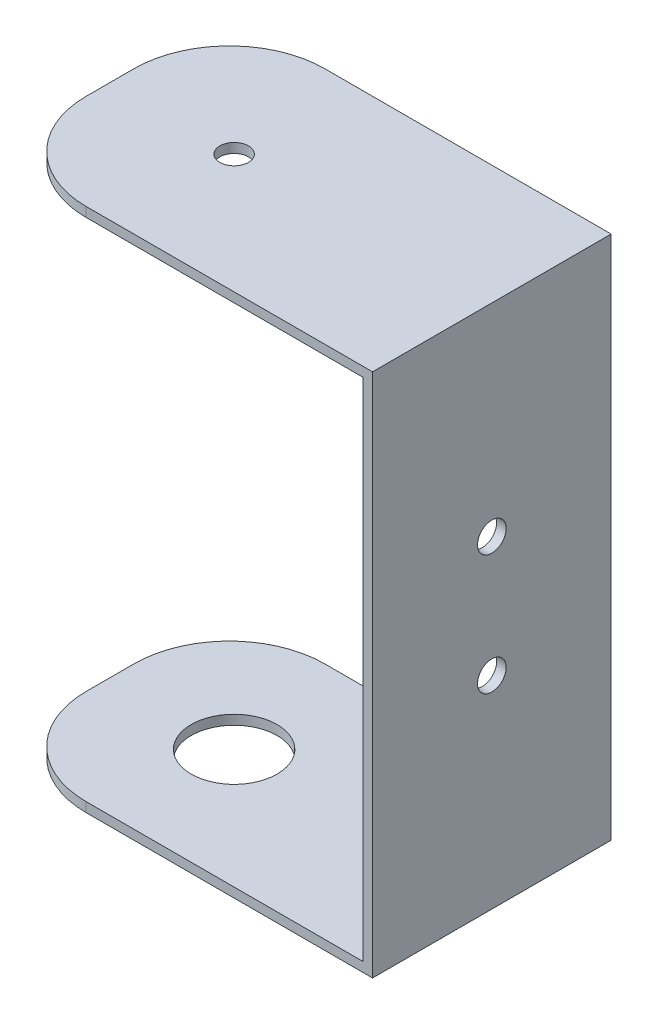
from build123d import *

# Parameters (mm, degrees)
EXTRUIR_L_MINA1_DEPTH = 25
CROQUIS2_R            = 1.5
CORTAR_EXTRUIR1_DEPTH = 1
CROQUIS5_R            = 4.5
CORTAR_EXTRUIR2_DEPTH = 1
CROQUIS6_R            = 1.5
CORTAR_EXTRUIR3_DEPTH = 1
REDONDEO1_R           = 10


with BuildPart() as part:
    # Croquis1 → Extruir-Lámina1 (new body)
    with BuildSketch(Plane.XY):
        Polygon((-39, 17.149283258), (0, 17.149283258), (0, -35.850716742), (-39, -35.850716742), (-39, -36.850716742), (1, -36.850716742), (1, 18.149283258), (-39, 18.149283258), align=None)
    extrude(amount=EXTRUIR_L_MINA1_DEPTH)

    # Croquis2 → Cortar-Extruir1 (cut)
    with BuildSketch(Plane(origin=(0, 18.149283258, 0), x_dir=(1, 0, 0), z_dir=(0, 1, 0))):
        with Locations(Location((-26, -12.5, 0), (0, 0, 180))):
            Circle(CROQUIS2_R)
    extrude(amount=-CORTAR_EXTRUIR1_DEPTH, mode=Mode.SUBTRACT)

    # Croquis5 → Cortar-Extruir2 (cut)
    with BuildSketch(Plane.XZ.offset(36.850716742)):
        with Locations((-26, 12.5)):
            Circle(CROQUIS5_R)
    extrude(amount=-CORTAR_EXTRUIR2_DEPTH, mode=Mode.SUBTRACT)

    # Croquis6 → Cortar-Extruir3 (cut)
    with BuildSketch(Plane(origin=(1, 0, 0), x_dir=(0, 0, -1), z_dir=(1, 0, 0))):
        with Locations(Location((-12.5, -15.650716742, 0), (0, 0, 90))):
            Circle(CROQUIS6_R)
        with Locations(Location((-12.5, -3.050716742, 0), (0, 0, 90))):
            Circle(CROQUIS6_R)
    extrude(amount=-CORTAR_EXTRUIR3_DEPTH, mode=Mode.SUBTRACT)

    # Redondeo1
    redondeo1_edges = [part.edges().sort_by_distance(p)[0] for p in [
        (-39, -36.350716742, 25),
        (-39, 17.649283258, 25),
        (-39, -36.350716742, 0),
        (-39, 17.649283258, 0),
    ]]
    fillet(redondeo1_edges, radius=REDONDEO1_R)


solid = part.part
